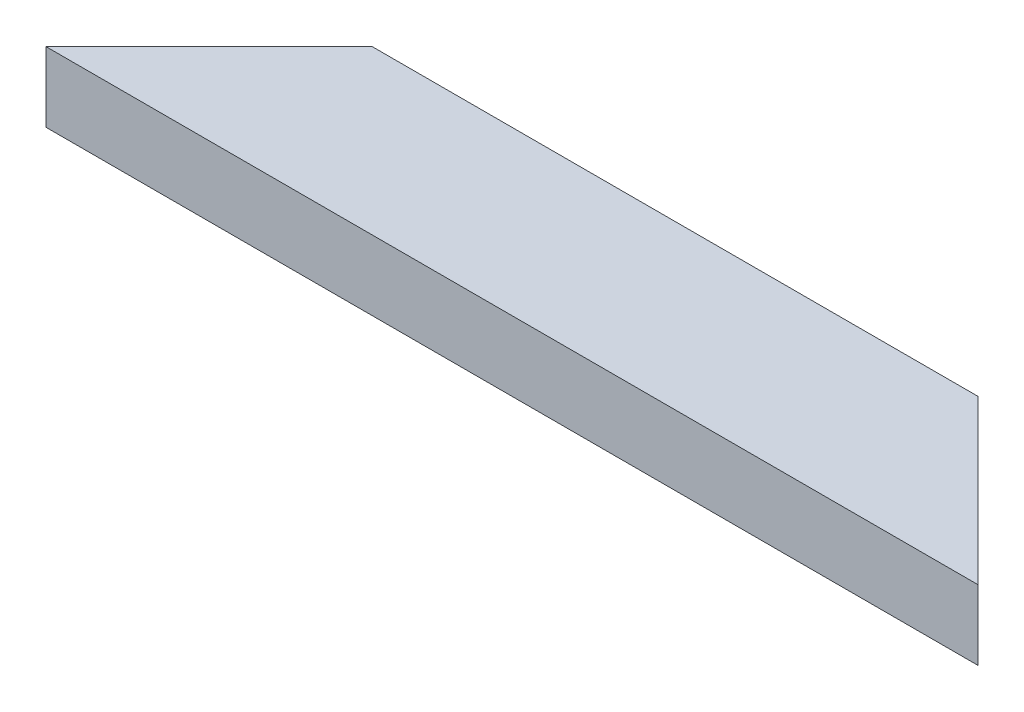
from build123d import *

# Parameters (mm, degrees)
BOSS_EXTRUDE1_DEPTH = 38.1


with BuildPart() as part:
    # Sketch1 → Boss-Extrude1 (new body)
    with BuildSketch(Plane(origin=(0, 0, 0), x_dir=(1, 0, 0), z_dir=(0, 1, 0))):
        Polygon((88.9, 88.9), (0, 0), (508, 0), (419.1, 88.9), align=None)
    extrude(amount=BOSS_EXTRUDE1_DEPTH)


solid = part.part
